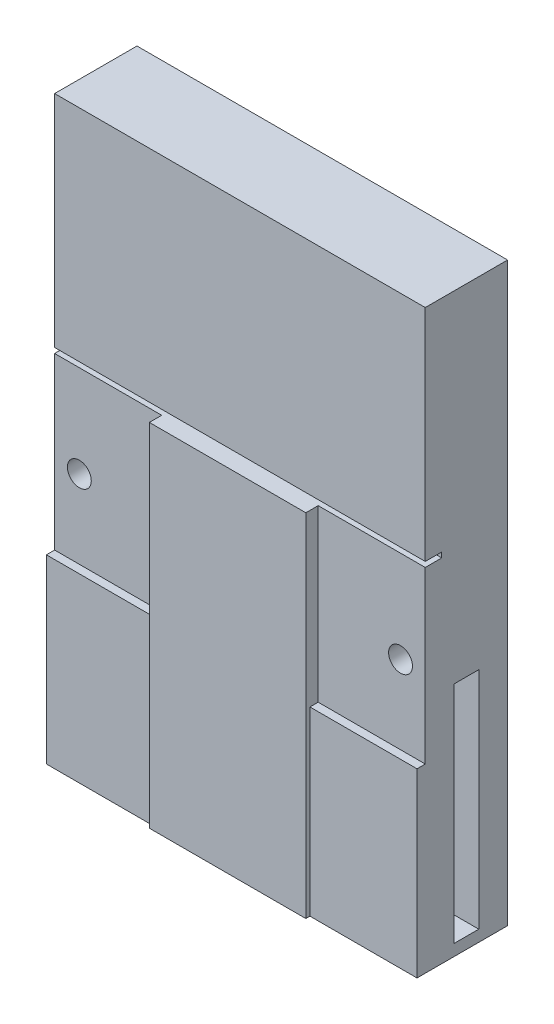
from build123d import *

# Parameters (mm, degrees)
SKETCH2_W           = 45
SKETCH2_H           = 10
BOSS_EXTRUDE1_DEPTH = 40
SKETCH4_W           = 45
SKETCH4_H           = 10
BOSS_EXTRUDE2_DEPTH = 10
SKETCH8_W           = 45
SKETCH8_H           = 10
BOSS_EXTRUDE3_DEPTH = 20
SKETCH9_R           = 1.45
CUT_EXTRUDE2_DEPTH  = 20
SKETCH10_W          = 45
SKETCH10_H          = 0.626165357
CUT_EXTRUDE3_DEPTH  = 2
SKETCH11_W          = 19
SKETCH11_H          = 42.671327575
BOSS_EXTRUDE4_DEPTH = 1.5
SKETCH12_W          = 3
SKETCH12_H          = 27.286335608
CUT_EXTRUDE6_DEPTH  = 10
SKETCH13_W          = 13
SKETCH13_H          = 22
BOSS_EXTRUDE5_DEPTH = 1


with BuildPart() as part:
    # Sketch2 → Boss-Extrude1 (new body)
    with BuildSketch(Plane(origin=(0, 0, 0), x_dir=(1, 0, 0), z_dir=(0, 1, 0))):
        Rectangle(SKETCH2_W, SKETCH2_H)
    extrude(amount=BOSS_EXTRUDE1_DEPTH)

    # Sketch4 → Boss-Extrude2 (add)
    with BuildSketch(Plane(origin=(0, 40, 0), x_dir=(1, 0, 0), z_dir=(0, 1, 0))):
        Rectangle(SKETCH4_W, SKETCH4_H)
    extrude(amount=BOSS_EXTRUDE2_DEPTH)

    # Sketch8 → Boss-Extrude3 (add)
    with BuildSketch(Plane.XZ):
        Rectangle(SKETCH8_W, SKETCH8_H)
    extrude(amount=BOSS_EXTRUDE3_DEPTH)

    # Sketch9 → Cut-Extrude2 (cut)
    with BuildSketch(Plane.XY.offset(5)):
        with Locations((19.5, 11.5)):
            Circle(SKETCH9_R)
        with Locations((-19.5, 11.5)):
            Circle(SKETCH9_R)
    extrude(amount=-CUT_EXTRUDE2_DEPTH, mode=Mode.SUBTRACT)

    # Sketch10 → Cut-Extrude3 (cut)
    with BuildSketch(Plane.XY.offset(5)):
        with Locations((0, 22.984410254)):
            Rectangle(SKETCH10_W, SKETCH10_H)
    extrude(amount=-CUT_EXTRUDE3_DEPTH, mode=Mode.SUBTRACT)

    # Sketch11 → Boss-Extrude4 (add)
    with BuildSketch(Plane.XY.offset(5)):
        with Locations((0, 1.335663788)):
            Rectangle(SKETCH11_W, SKETCH11_H)
    extrude(amount=BOSS_EXTRUDE4_DEPTH)

    # Sketch12 → Cut-Extrude6 (cut)
    with BuildSketch(Plane(origin=(22.5, 0, 0), x_dir=(0, 0, -1), z_dir=(1, 0, 0))):
        with Locations((0, -4.971840229)):
            Rectangle(SKETCH12_W, SKETCH12_H)
    cut_extrude6 = extrude(amount=-CUT_EXTRUDE6_DEPTH, mode=Mode.SUBTRACT)

    # Sketch13 → Boss-Extrude5 (add)
    with BuildSketch(Plane.XY.offset(5)):
        with Locations((16, -9)):
            Rectangle(SKETCH13_W, SKETCH13_H)
    boss_extrude5 = extrude(amount=BOSS_EXTRUDE5_DEPTH)

    # Mirror1: Cut-Extrude6 across plane
    add(cut_extrude6.mirror(Plane(origin=(0, 0, 0), x_dir=(0, 0, 1), z_dir=(1, 0, 0))), mode=Mode.SUBTRACT)

    # Mirror2: Boss-Extrude5 across plane
    add(boss_extrude5.mirror(Plane(origin=(0, 0, 0), x_dir=(0, 0, 1), z_dir=(1, 0, 0))))


solid = part.part
